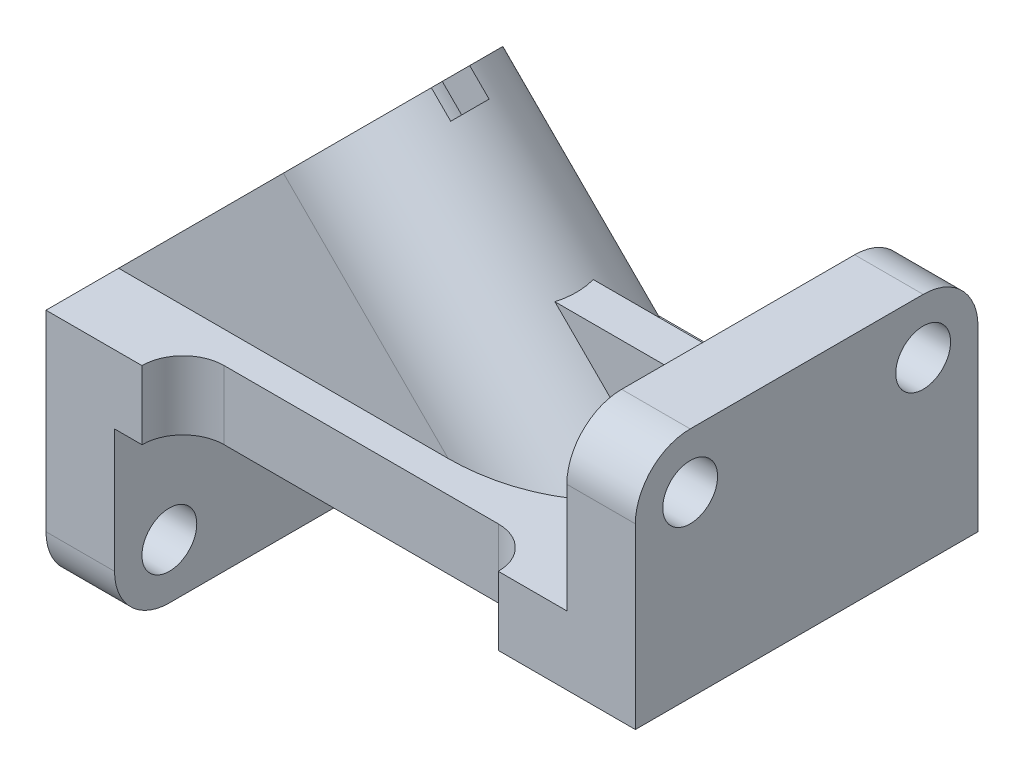
from build123d import *

# Parameters (mm, degrees)
BOSS_EXTRUDE1_DEPTH                      = 62.5
BOSS_EXTRUDE2_REACH                      = 273.512
CUT_EXTRUDE1_DEPTH                       = 229.538281314
FILLET1_R                                = 20
SKETCH6_R                                = 10
CUT_EXTRUDE2_DEPTH                       = 267.134431621
CUT_EXTRUDE3_DEPTH                       = 10
CBORE_FOR_M24_HEX_HEAD_BOLT1_D           = 26
CBORE_FOR_M24_HEX_HEAD_BOLT1_CBORE_D     = 44.569
CBORE_FOR_M24_HEX_HEAD_BOLT1_CBORE_DEPTH = 15
CUT_EXTRUDE4_START                       = 165
SKETCH6_3_R                              = 10
CUT_EXTRUDE4_DEPTH                       = 101.814175539
BOSS_EXTRUDE4_DEPTH                      = 7


with BuildPart() as part:
    # Sketch1 → Boss-Extrude1 (new, symmetric)
    with BuildSketch(Plane.XY):
        Polygon((190, 150), (190, 65), (0, 65), (0, 0), (-25, 0), (-25, 90), (165, 90), (165, 150), align=None)
    extrude(amount=BOSS_EXTRUDE1_DEPTH, both=True)

    # Sketch4 → Boss-Extrude2 (add, up to next)
    with BuildSketch(Plane(origin=(-57.5, 57.5, 0), x_dir=(0.7071067811865475, 0.7071067811865477, 0), z_dir=(0.7071067811865477, -0.7071067811865475, 0)), mode=Mode.PRIVATE) as boss_extrude2_sk1:
        with BuildLine():
            Line((45.961940777, -36), (130.961940777, -36))
            ThreePointArc((130.961940777, -36), (166.961940777, 0), (130.961940777, 36))
            Line((130.961940777, 36), (45.961940777, 36))
            Line((45.961940777, 36), (45.961940777, -36))
        make_face()
    boss_extrude2_tool1 = extrude(boss_extrude2_sk1.sketch, amount=BOSS_EXTRUDE2_REACH, mode=Mode.PRIVATE) - part.part
    add(boss_extrude2_tool1.solids().sort_by_distance((15.250037, 130.250037, 0))[0])

    # Sketch5 → Cut-Extrude1 (cut, through all)
    with BuildSketch(Plane(origin=(0, 65, 0), x_dir=(-1, 0, 0), z_dir=(0, -1, 0))):
        with BuildLine():
            Line((-125, -47.5), (-25, -47.5))
            ThreePointArc((-25, -47.5), (-14.393398282, -73.106601718), (-40, -62.5))
            Line((-40, -62.5), (-110, -62.5))
            ThreePointArc((-110, -62.5), (-135.606601718, -73.106601718), (-125, -47.5))
        make_face()
        with BuildLine():
            Line((-125, 47.5), (-25, 47.5))
            ThreePointArc((-25, 47.5), (-14.393398282, 73.106601718), (-40, 62.5))
            Line((-40, 62.5), (-110, 62.5))
            ThreePointArc((-110, 62.5), (-135.606601718, 73.106601718), (-125, 47.5))
        make_face()
    extrude(amount=-CUT_EXTRUDE1_DEPTH, mode=Mode.SUBTRACT)

    # Fillet1
    fillet1_edges = [part.edges().sort_by_distance(p)[0] for p in [
        (177.5, 150, -62.5),
        (-12.5, 0, 62.5),
        (177.5, 150, 62.5),
        (-12.5, 0, -62.5),
    ]]
    fillet(fillet1_edges, radius=FILLET1_R)

    # Sketch6 → Cut-Extrude2 (cut, through all)
    with BuildSketch(Plane(origin=(0, 0, 0), x_dir=(0, 0, -1), z_dir=(1, 0, 0))):
        with Locations((42.5, 20)):
            Circle(SKETCH6_R)
        with Locations((-42.5, 20)):
            Circle(SKETCH6_R)
    extrude(amount=-CUT_EXTRUDE2_DEPTH, mode=Mode.SUBTRACT)

    # Sketch7 → Cut-Extrude3 (cut)
    with BuildSketch(Plane(origin=(-57.5, 57.5, 0), x_dir=(0, 0, 1), z_dir=(-0.7071067811865438, 0.7071067811865513, 0))):
        with BuildLine():
            Line((-7, 166.274827943), (-7, 27.494892071))
            Line((-7, 27.494892071), (7, 27.494892071))
            Line((7, 27.494892071), (7, 166.274827943))
            ThreePointArc((7, 166.274827943), (0, 166.961940777), (-7, 166.274827943))
        make_face()
    extrude(amount=-CUT_EXTRUDE3_DEPTH, mode=Mode.SUBTRACT)

    # CBORE for M24 Hex Head Bolt1 (through all)
    with Locations(Plane(origin=(-57.5, 57.5, 0), x_dir=(0, 0, 1), z_dir=(-0.7071067811865438, 0.7071067811865513, 0))):
        with Locations((0, 130.961940777)):
            CounterBoreHole(CBORE_FOR_M24_HEX_HEAD_BOLT1_D / 2, CBORE_FOR_M24_HEX_HEAD_BOLT1_CBORE_D / 2, CBORE_FOR_M24_HEX_HEAD_BOLT1_CBORE_DEPTH)

    # Sketch6<3> → Cut-Extrude4 (cut, through all)
    with BuildSketch(Plane(origin=(0, 0, 0), x_dir=(0, 0, -1), z_dir=(1, 0, 0)).offset(CUT_EXTRUDE4_START)):
        with Locations((42.5, 20)):
            Circle(SKETCH6_3_R)
        with Locations((-42.5, 20)):
            Circle(SKETCH6_3_R)
        with Locations((42.5, 130)):
            Circle(SKETCH6_3_R)
        with Locations((-42.5, 130)):
            Circle(SKETCH6_3_R)
    extrude(amount=CUT_EXTRUDE4_DEPTH, mode=Mode.SUBTRACT)

    # Sketch11 → Boss-Extrude4 (add, symmetric)
    with BuildSketch(Plane.XY):
        Polygon((165, 130), (97.583974217, 130), (137.512677947, 90), (165, 90), align=None)
    extrude(amount=BOSS_EXTRUDE4_DEPTH, both=True)


solid = part.part
